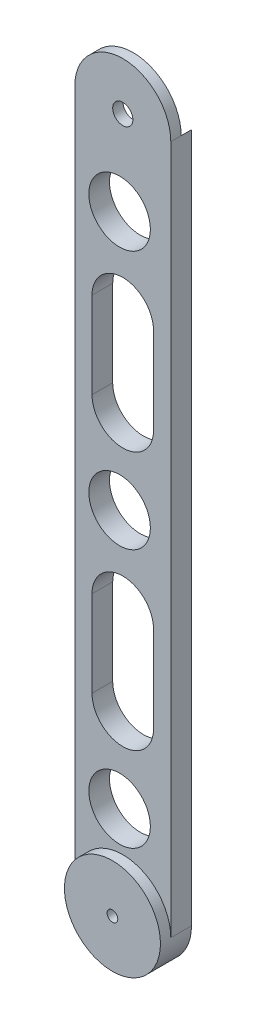
from build123d import *

# Parameters (mm, degrees)
ESQUISSE1_W             = 27.85
ESQUISSE1_H             = 200
BOSS_EXTRU_1_DEPTH      = 6
ENL_V_START             = -3
ESQUISSE2_R             = 13.925
ENL_V_MAT_EXTRU_1_DEPTH = 3
ESQUISSE3_R             = 1.55
ENL_V_MAT_EXTRU_2_DEPTH = 3
ESQUISSE6_R             = 8.925
ESQUISSE6_W             = 17.85
ESQUISSE6_H             = 25
ENL_V_MAT_EXTRU_4_DEPTH = 10
ESQUISSE7_R             = 2.925
ENL_V_MAT_EXTRU_5_DEPTH = 10
ESQUISSE4_R             = 13.925
ENL_V_MAT_EXTRU_6_DEPTH = 3
ESQUISSE8_R             = 13.925
ESQUISSE8_R_2           = 1.55
BOSS_EXTRU_2_DEPTH      = 6
ESQUISSE9_R             = 4
ENL_V_MAT_EXTRU_7_DEPTH = 2.5


with BuildPart() as part:
    # Esquisse1 → Boss.-Extru.1 (new body)
    with BuildSketch(Plane.XY):
        with Locations((3.966452722, -72.813095238)):
            Rectangle(ESQUISSE1_W, ESQUISSE1_H)
        with BuildLine():
            Line((-9.958547278, -172.813095238), (17.891452722, -172.813095238))
            ThreePointArc((17.891452722, -172.813095238), (3.966452722, -186.738095238), (-9.958547278, -172.813095238))
        make_face()
        with BuildLine():
            Line((-9.958547278, 27.186904762), (17.891452722, 27.186904762))
            ThreePointArc((17.891452722, 27.186904762), (3.966452722, 41.111904762), (-9.958547278, 27.186904762))
        make_face()
    extrude(amount=BOSS_EXTRU_1_DEPTH)

    # Esquisse2 → Enlèv. mat.-Extru.1 (cut)
    with BuildSketch(Plane.XY.offset(6).offset(ENL_V_START)):
        with Locations((3.966452722, -172.813095238)):
            Circle(ESQUISSE2_R)
    extrude(amount=ENL_V_MAT_EXTRU_1_DEPTH, mode=Mode.SUBTRACT)

    # Esquisse3 → Enlèv. mat.-Extru.2 (cut)
    with BuildSketch(Plane.XY.offset(3)):
        with Locations((3.966452722, -172.813095238)):
            Circle(ESQUISSE3_R)
    extrude(amount=-ENL_V_MAT_EXTRU_2_DEPTH, mode=Mode.SUBTRACT)

    # Esquisse6 → Enlèv. mat.-Extru.4 (cut)
    with BuildSketch(Plane(origin=(0, 0, 0), x_dir=(-1, 0, 0), z_dir=(0, 0, -1))):
        with Locations((-3.040571359, 2.186904762)):
            Circle(ESQUISSE6_R)
        with BuildLine():
            ThreePointArc((-12.891452722, -22.813095238), (-3.966452722, -13.888095238), (4.958547278, -22.813095238))
            Line((4.958547278, -22.813095238), (-12.891452722, -22.813095238))
        make_face()
        with Locations((-3.966452722, -35.313095238)):
            Rectangle(ESQUISSE6_W, ESQUISSE6_H)
        with BuildLine():
            ThreePointArc((4.958547278, -47.813095238), (-3.966452722, -56.738095238), (-12.891452722, -47.813095238))
            Line((-12.891452722, -47.813095238), (4.958547278, -47.813095238))
        make_face()
        with Locations((-3.040571359, -72.813095238)):
            Circle(ESQUISSE6_R)
        with Locations((-3.966452722, -110.313095238)):
            Rectangle(ESQUISSE6_W, ESQUISSE6_H)
        with BuildLine():
            ThreePointArc((-12.891452722, -97.813095238), (-3.966452722, -88.888095238), (4.958547278, -97.813095238))
            Line((4.958547278, -97.813095238), (-12.891452722, -97.813095238))
        make_face()
        with BuildLine():
            ThreePointArc((4.958547278, -122.813095238), (-3.966452722, -131.738095238), (-12.891452722, -122.813095238))
            Line((-12.891452722, -122.813095238), (4.958547278, -122.813095238))
        make_face()
        with Locations((-3.040571359, -147.813095238)):
            Circle(ESQUISSE6_R)
    extrude(amount=-ENL_V_MAT_EXTRU_4_DEPTH, mode=Mode.SUBTRACT)

    # Esquisse7 → Enlèv. mat.-Extru.5 (cut)
    with BuildSketch(Plane(origin=(0, 0, 0), x_dir=(-1, 0, 0), z_dir=(0, 0, -1))):
        with Locations((-3.966452722, 27.186904762)):
            Circle(ESQUISSE7_R)
    extrude(amount=-ENL_V_MAT_EXTRU_5_DEPTH, mode=Mode.SUBTRACT)

    # Esquisse4 → Enlèv. mat.-Extru.6 (cut)
    with BuildSketch(Plane(origin=(0, 0, 0), x_dir=(-1, 0, 0), z_dir=(0, 0, -1))):
        with Locations((-3.966452722, 27.186904762)):
            Circle(ESQUISSE4_R)
    extrude(amount=-ENL_V_MAT_EXTRU_6_DEPTH, mode=Mode.SUBTRACT)

    # Esquisse8 → Boss.-Extru.2 (add)
    with BuildSketch(Plane.XY.offset(3)):
        with Locations((3.966452722, -172.813095238)):
            Circle(ESQUISSE8_R)
        with Locations((3.966452722, -172.813095238)):
            Circle(ESQUISSE8_R_2, mode=Mode.SUBTRACT)
    extrude(amount=BOSS_EXTRU_2_DEPTH)

    # Esquisse9 → Enlèv. mat.-Extru.7 (cut)
    with BuildSketch(Plane(origin=(0, 0, 0), x_dir=(-1, 0, 0), z_dir=(0, 0, -1))):
        with Locations((-3.966452722, -172.813095238)):
            Circle(ESQUISSE9_R)
    extrude(amount=-ENL_V_MAT_EXTRU_7_DEPTH, mode=Mode.SUBTRACT)


solid = part.part
